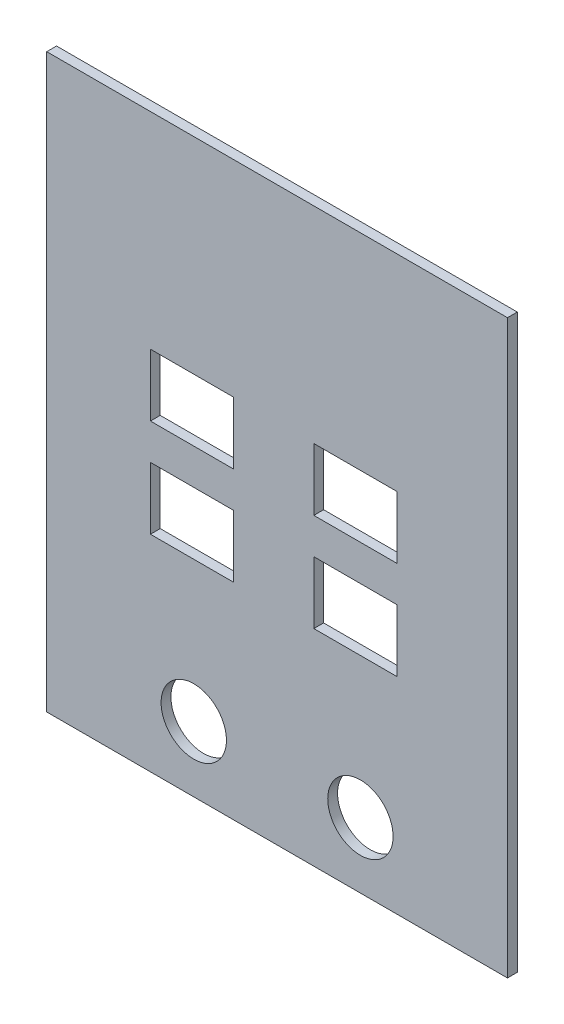
from build123d import *

# Parameters (mm, degrees)
SKETCH1_W               = 141
SKETCH1_H               = 175
BOSS_EXTRUDE1_DEPTH     = 3
CUT_EXTRUDE1_DEPTH      = 132.816914117
CUT_EXTRUDE1_DEPTH_BACK = 132.816914117
SKETCH4_W               = 25.4
SKETCH4_H               = 19.05
SKETCH5_R               = 10
CUT_EXTRUDE2_DEPTH      = 132.816914117


with BuildPart() as part:
    # Sketch1 → Boss-Extrude1 (new body)
    with BuildSketch(Plane.XY):
        with Locations((1.330188679, -22.985849057)):
            Rectangle(SKETCH1_W, SKETCH1_H)
    extrude(amount=BOSS_EXTRUDE1_DEPTH)

    # Sketch4 → Cut-Extrude1 (cut, two sides: drawn at the far end of the back side and taken through both)
    with BuildSketch(Plane.XY.offset(3).offset(-CUT_EXTRUDE1_DEPTH_BACK)):
        with Locations((25.270813238, -37.985849057)):
            Rectangle(SKETCH4_W, SKETCH4_H)
        with Locations((25.270813238, -7.985849057)):
            Rectangle(SKETCH4_W, SKETCH4_H)
        with Locations((-24.729186762, -37.985849057)):
            Rectangle(SKETCH4_W, SKETCH4_H)
        with Locations((-24.729186762, -7.985849057)):
            Rectangle(SKETCH4_W, SKETCH4_H)
    extrude(amount=CUT_EXTRUDE1_DEPTH + CUT_EXTRUDE1_DEPTH_BACK, mode=Mode.SUBTRACT)

    # Sketch5 → Cut-Extrude2 (cut, through all)
    with BuildSketch(Plane.XY.offset(3)):
        with Locations((-24.169811321, -90.485849057)):
            Circle(SKETCH5_R)
        with Locations(Location((26.830188679, -90.485849057, 0), (0, 0, 180))):
            Circle(SKETCH5_R)
    extrude(amount=-CUT_EXTRUDE2_DEPTH, mode=Mode.SUBTRACT)


solid = part.part
